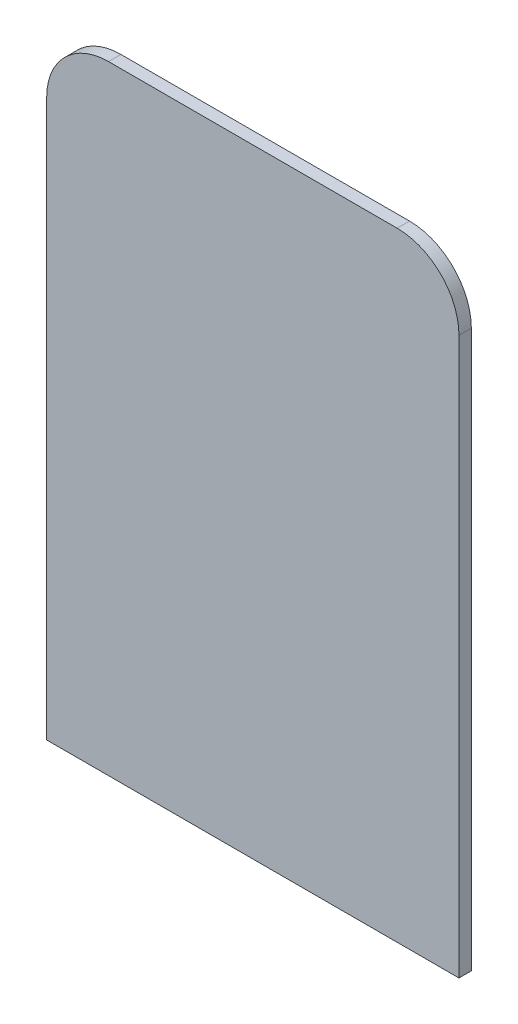
from build123d import *

# Parameters (mm, degrees)
BOSS_EXTRUDE5_DEPTH = 3


with BuildPart() as part:
    # Sketch18 → Boss-Extrude5 (new body)
    with BuildSketch(Plane.XY):
        with BuildLine():
            Line((-50, -75), (50, -75))
            Line((50, -75), (50, 60))
            ThreePointArc((50, 60), (45.606601718, 70.606601718), (35, 75))
            Line((35, 75), (-35, 75))
            ThreePointArc((-35, 75), (-45.606601718, 70.606601718), (-50, 60))
            Line((-50, 60), (-50, -75))
        make_face()
    extrude(amount=BOSS_EXTRUDE5_DEPTH)


solid = part.part
